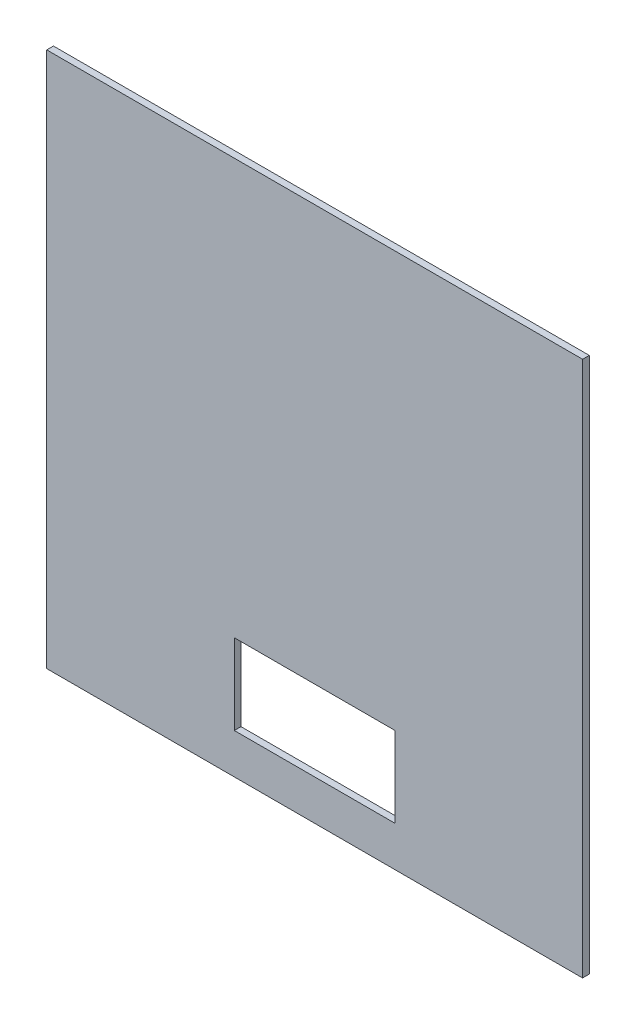
from build123d import *

# Parameters (mm, degrees)
SKETCH1_W           = 254
SKETCH1_H           = 254
SKETCH1_W_2         = 76.2
SKETCH1_H_2         = 38.1
BOSS_EXTRUDE1_DEPTH = 1.5875


with BuildPart() as part:
    # Sketch1 → Boss-Extrude1 (new, symmetric)
    with BuildSketch(Plane.XY):
        Rectangle(SKETCH1_W, SKETCH1_H)
        with Locations((0, -88.9)):
            Rectangle(SKETCH1_W_2, SKETCH1_H_2, mode=Mode.SUBTRACT)
    extrude(amount=BOSS_EXTRUDE1_DEPTH, both=True)


solid = part.part
